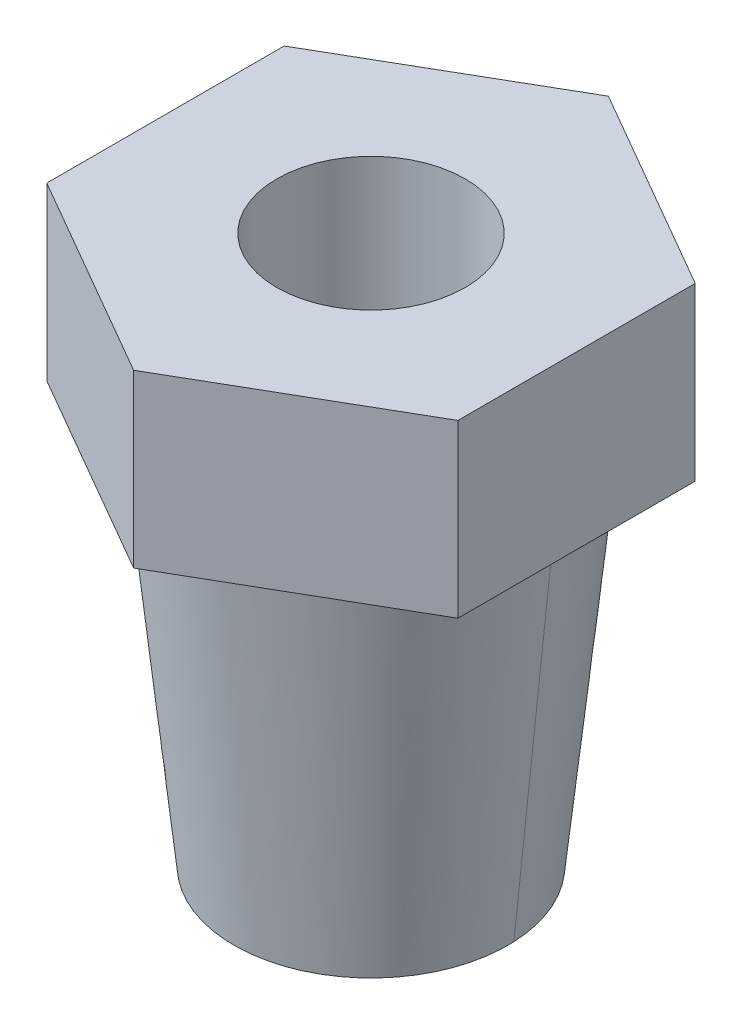
from build123d import *

# Parameters (mm, degrees)
RESSALTO_EXTRUS_O1_DEPTH = 5
ESBO_O2_R                = 4
RESSALTO_EXTRUS_O2_DEPTH = 11
ESBO_O3_R                = 2.75
CORTE_EXTRUS_O1_DEPTH    = 22


with BuildPart() as part:
    # Esboço1 → Ressalto-extrusão1 (new body)
    with BuildSketch(Plane(origin=(0, 0, 0), x_dir=(1, 0, 0), z_dir=(0, 1, 0))):
        Polygon((0, -6.92820323), (6, -3.464101615), (6, 3.464101615), (0, 6.92820323), (-6, 3.464101615), (-6, -3.464101615), align=None)
    extrude(amount=-RESSALTO_EXTRUS_O1_DEPTH)


with BuildPart() as body_2:
    # Esboço2 → Ressalto-extrusão2 (new body)
    with BuildSketch(Plane.XZ.offset(5)):
        with Locations(Location((0, 0, 0), (0, 0, 270))):
            Circle(ESBO_O2_R)
    extrude(amount=RESSALTO_EXTRUS_O2_DEPTH)


with BuildPart() as corte_extrus_o1_tool:
    # Esboço3 → Corte-extrusão1 (new body)
    with BuildSketch(Plane.XZ.offset(16)):
        with Locations(Location((0, 0, 0), (0, 0, 90))):
            Circle(ESBO_O3_R)
    extrude(amount=-CORTE_EXTRUS_O1_DEPTH)


with BuildPart() as part_1:
    add(part.part)

    # Corte-extrusão1: cut by corte_extrus_o1_tool
    add(corte_extrus_o1_tool.part, mode=Mode.SUBTRACT)



with BuildPart() as body_2_1:
    add(body_2.part)

    # Corte-extrusão1: cut by corte_extrus_o1_tool
    add(corte_extrus_o1_tool.part, mode=Mode.SUBTRACT)


with BuildPart() as part_2:
    add(part_1.part)

    add(body_2_1.part)  # Varredura1 merges body 2
    # Varredura1: sweep along a curve in space
    with BuildLine() as varredura1_path:
        ThreePointArc((0, -16, -4), (2.828427125, -16, -2.828427125), (4, -16, 0))
        ThreePointArc((4, -16, 0), (2.828427125, -16, 2.828427125), (0, -16, 4))
        ThreePointArc((0, -16, 4), (-2.828427125, -16, 2.828427125), (-4, -16, 0))
        ThreePointArc((-4, -16, 0), (-2.828427125, -16, -2.828427125), (0, -16, -4))
    # 3DSketch3 → Varredura1 (sweep)
    with BuildSketch(Plane(origin=(3.994740422, -5, -0.205058439), x_dir=(0.00013207405092369588, -0.999996124817467, 0.0027808104024168727), z_dir=(0, 0.0027808104266704827, 0.9999961335392108))):
        Polygon((0, 0), (0.000151027, 1.14349999), (11.000042627, 0), align=None)
    sweep(path=varredura1_path.line)


solid = part_2.part
